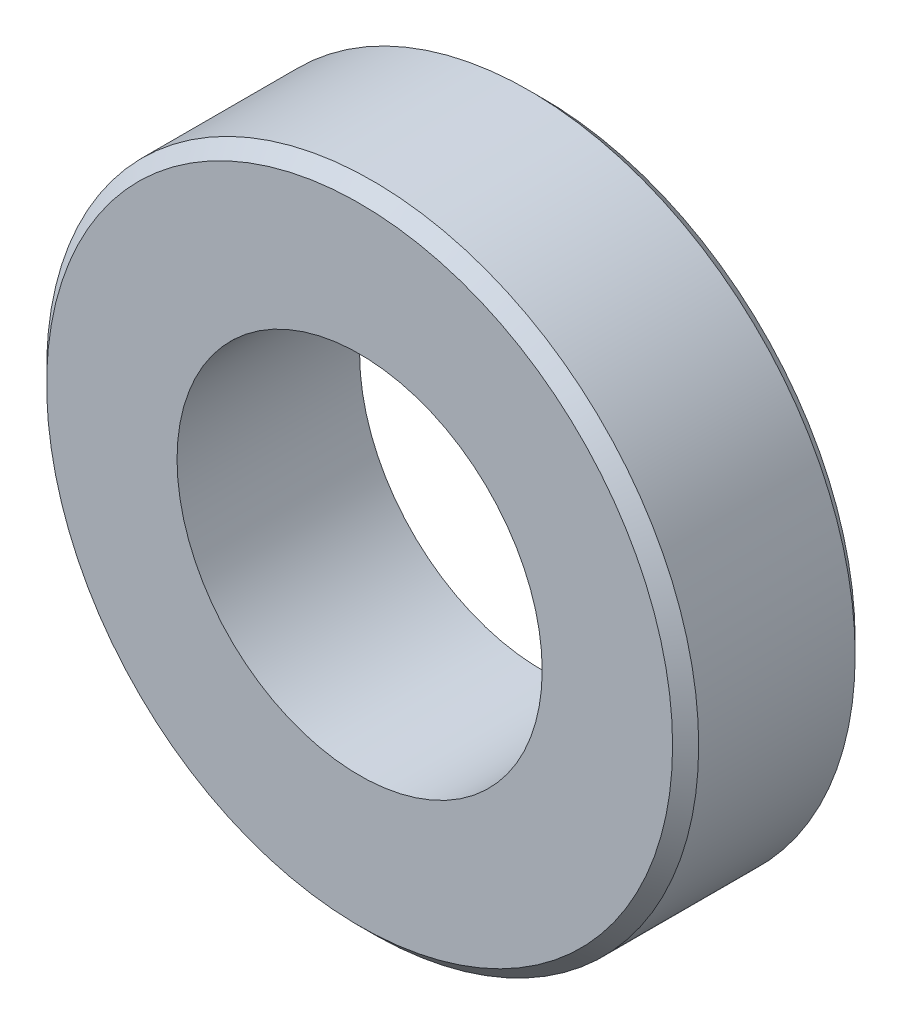
from build123d import *

# Parameters (mm, degrees)
SKETCH_1_R      = 12.5
SKETCH_1_R_2    = 7
EXTRUDE_1_DEPTH = 7
CHAMFER_1_SIZE  = 0.5


with BuildPart() as part:
    # 草圖1 → 填料-伸長1 (new body)
    with BuildSketch(Plane.XY):
        Circle(SKETCH_1_R)
        Circle(SKETCH_1_R_2, mode=Mode.SUBTRACT)
    extrude(amount=EXTRUDE_1_DEPTH)

    # 導角1
    chamfer_1_edges = [part.edges().sort_by_distance(p)[0] for p in [
        (-12.5, 0, 0),
        (-12.5, 0, 7),
    ]]
    chamfer(chamfer_1_edges, length=CHAMFER_1_SIZE)


solid = part.part
